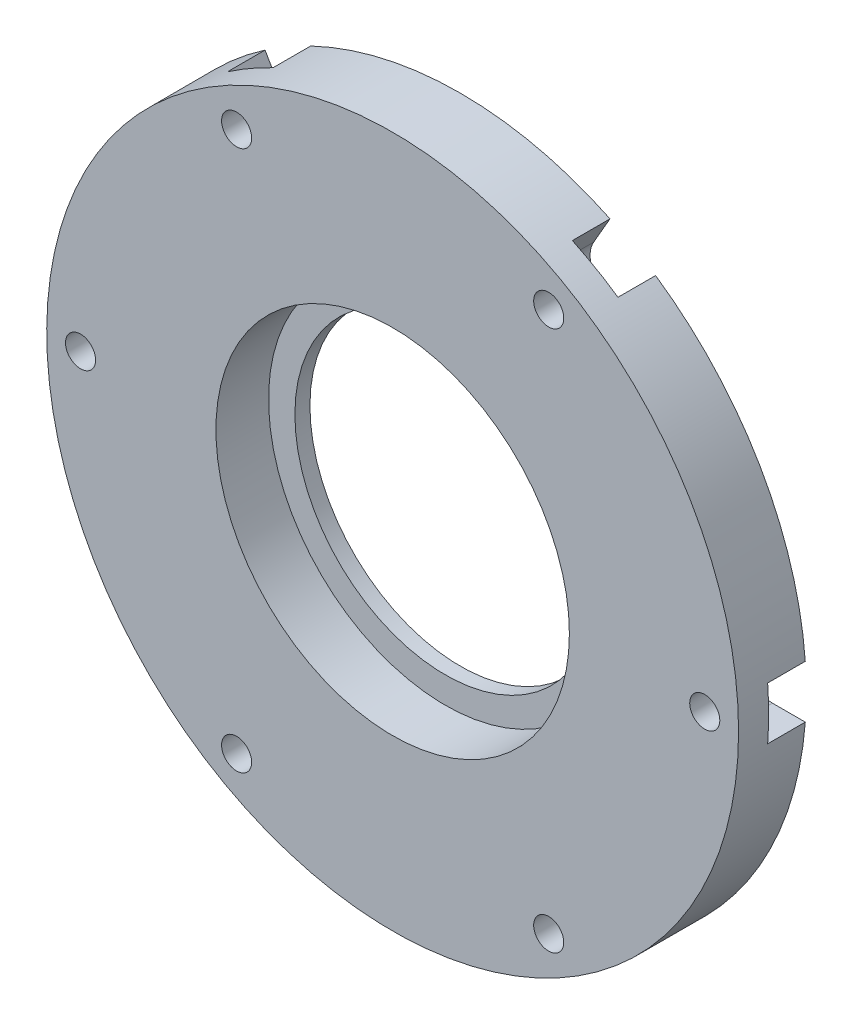
from build123d import *

# Parameters (mm, degrees)
SKETCH1_R           = 46
SKETCH1_R_2         = 2
BOSS_EXTRUDE1_DEPTH = 9
SKETCH2_R           = 23.5
CUT_EXTRUDE1_DEPTH  = 7
SKETCH3_R           = 20
CUT_EXTRUDE2_DEPTH  = 66.429351212
SKETCH4_R           = 3.5
CUT_EXTRUDE3_DEPTH  = 5
CUT_EXTRUDE4_DEPTH  = 5


with BuildPart() as part:
    # Sketch1 → Boss-Extrude1 (new body)
    with BuildSketch(Plane.XY):
        Circle(SKETCH1_R)
        with Locations((41.5, 0)):
            Circle(SKETCH1_R_2, mode=Mode.SUBTRACT)
        with Locations((20.75, -35.940054257)):
            Circle(SKETCH1_R_2, mode=Mode.SUBTRACT)
        with Locations((-20.75, -35.940054257)):
            Circle(SKETCH1_R_2, mode=Mode.SUBTRACT)
        with Locations((-41.5, 0)):
            Circle(SKETCH1_R_2, mode=Mode.SUBTRACT)
        with Locations((-20.75, 35.940054257)):
            Circle(SKETCH1_R_2, mode=Mode.SUBTRACT)
        with Locations((20.75, 35.940054257)):
            Circle(SKETCH1_R_2, mode=Mode.SUBTRACT)
    extrude(amount=BOSS_EXTRUDE1_DEPTH)

    # Sketch2 → Cut-Extrude1 (cut)
    with BuildSketch(Plane.XY.offset(9)):
        Circle(SKETCH2_R)
    extrude(amount=-CUT_EXTRUDE1_DEPTH, mode=Mode.SUBTRACT)

    # Sketch3 → Cut-Extrude2 (cut, through all)
    with BuildSketch(Plane.XY.offset(2)):
        Circle(SKETCH3_R)
    extrude(amount=-CUT_EXTRUDE2_DEPTH, mode=Mode.SUBTRACT)

    # Sketch4 → Cut-Extrude3 (cut)
    with BuildSketch(Plane(origin=(0, 0, 0), x_dir=(-1, 0, 0), z_dir=(0, 0, -1))):
        with Locations((-20.75, 35.940054257)):
            Circle(SKETCH4_R)
        with Locations((20.75, 35.940054257)):
            Circle(SKETCH4_R)
        with Locations((41.5, 0)):
            Circle(SKETCH4_R)
        with Locations((20.75, -35.940054257)):
            Circle(SKETCH4_R)
        with Locations((-20.75, -35.940054257)):
            Circle(SKETCH4_R)
        with Locations((-41.5, 0)):
            Circle(SKETCH4_R)
    extrude(amount=-CUT_EXTRUDE3_DEPTH, mode=Mode.SUBTRACT)

    # Sketch5 → Cut-Extrude4 (cut)
    with BuildSketch(Plane(origin=(0, 0, 0), x_dir=(-1, 0, 0), z_dir=(0, 0, -1))):
        with BuildLine():
            ThreePointArc((-23.781088913, 34.190054257), (-22.5, 38.97114317), (-17.718911087, 37.690054257))
            Line((-17.718911087, 37.690054257), (-19.902238364, 41.471688031))
            ThreePointArc((-19.902238364, 41.471688031), (-23, 39.837168574), (-25.96441619, 37.971688031))
            Line((-25.96441619, 37.971688031), (-23.781088913, 34.190054257))
        make_face()
        with BuildLine():
            ThreePointArc((25.96441619, 37.971688031), (23, 39.837168574), (19.902238364, 41.471688031))
            Line((19.902238364, 41.471688031), (17.718911087, 37.690054257))
            ThreePointArc((17.718911087, 37.690054257), (22.5, 38.97114317), (23.781088913, 34.190054257))
            Line((23.781088913, 34.190054257), (25.96441619, 37.971688031))
        make_face()
        with BuildLine():
            Line((-41.5, 3.5), (-45.866654554, 3.5))
            ThreePointArc((-45.866654554, 3.5), (-46, 0), (-45.866654554, -3.5))
            Line((-45.866654554, -3.5), (-41.5, -3.5))
            ThreePointArc((-41.5, -3.5), (-45, 0), (-41.5, 3.5))
        make_face()
        with BuildLine():
            ThreePointArc((45.866654554, -3.5), (46, 0), (45.866654554, 3.5))
            Line((45.866654554, 3.5), (41.5, 3.5))
            ThreePointArc((41.5, 3.5), (45, 0), (41.5, -3.5))
            Line((41.5, -3.5), (45.866654554, -3.5))
        make_face()
        with BuildLine():
            Line((-23.781088913, -34.190054257), (-25.96441619, -37.971688031))
            ThreePointArc((-25.96441619, -37.971688031), (-23, -39.837168574), (-19.902238364, -41.471688031))
            Line((-19.902238364, -41.471688031), (-17.718911087, -37.690054257))
            ThreePointArc((-17.718911087, -37.690054257), (-22.5, -38.97114317), (-23.781088913, -34.190054257))
        make_face()
        with BuildLine():
            Line((17.718911087, -37.690054257), (19.902238364, -41.471688031))
            ThreePointArc((19.902238364, -41.471688031), (23, -39.837168574), (25.96441619, -37.971688031))
            Line((25.96441619, -37.971688031), (23.781088913, -34.190054257))
            ThreePointArc((23.781088913, -34.190054257), (22.5, -38.97114317), (17.718911087, -37.690054257))
        make_face()
    extrude(amount=-CUT_EXTRUDE4_DEPTH, mode=Mode.SUBTRACT)


solid = part.part
